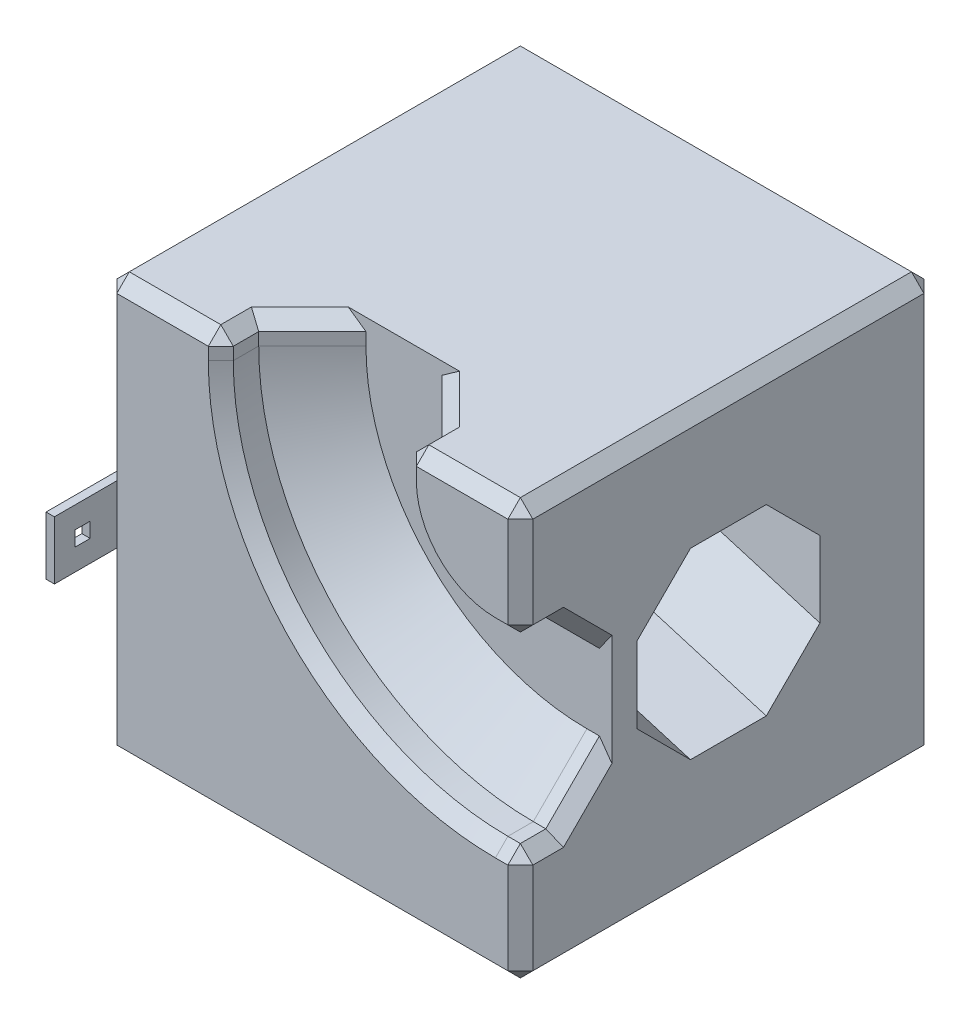
from build123d import *

# Parameters (mm, degrees)
SKETCH1_W                = 50
SKETCH1_H                = 50
BOSS_EXTRUDE1_DEPTH      = 50
CHAMFER1_SIZE            = 1.5
BOSS_EXTRUDE2_DEPTH      = 7
BOSS_EXTRUDE2_DEPTH_BACK = 7
SKETCH6_W                = 1
SKETCH6_H                = 7
SKETCH7_W                = 1.8
SKETCH7_H                = 1.8
CUT_EXTRUDE1_DEPTH       = 7


with BuildPart() as part:
    # Sketch1 → Boss-Extrude1 (new body)
    with BuildSketch(Plane.XY):
        with Locations((25, 25)):
            Rectangle(SKETCH1_W, SKETCH1_H)
    extrude(amount=BOSS_EXTRUDE1_DEPTH)

    # Cut-Sweep2: sweep along a path in Sketch4
    with BuildLine(Plane.XY.offset(50)) as cut_sweep2_path:
        Line((25, 50), (25, 47))
        ThreePointArc((25, 47), (31.443650814, 31.443650814), (47, 25))
        Line((47, 25), (50, 25))
    # Sketch3 → Cut-Sweep2 (sweep, cut)
    with BuildSketch(Plane.XZ.offset(-50)):
        Polygon((29.556349186, 39), (36, 45.443650814), (36, 54.556349186), (29.556349186, 61), (20.443650814, 61), (14, 54.556349186), (14, 45.443650814), (20.443650814, 39), align=None)
    sweep(path=cut_sweep2_path.line, mode=Mode.SUBTRACT)

    # Sketch5 → Cut-Loft1 section 0
    with BuildSketch(Plane.ZY):
        with BuildLine():
            Line((24.5, 20.443650814), (24.5, 29.556349186))
            Line((24.5, 29.556349186), (18.056349186, 36))
            Line((18.056349186, 36), (8.943650814, 36))
            Line((8.943650814, 36), (2.5, 29.556349186))
            Line((2.5, 29.556349186), (2.5, 20.443650814))
            Line((2.5, 20.443650814), (8.943650814, 14))
            Line((8.943650814, 14), (18.056349186, 14))
            Line((18.056349186, 14), (24.5, 20.443650814))
        make_face()
    # Sketch2 → Cut-Loft1 section 1
    with BuildSketch(Plane.ZY.offset(-50)):
        with BuildLine():
            Line((36, 29.556349186), (29.556349186, 36))
            Line((29.556349186, 36), (20.443650814, 36))
            Line((20.443650814, 36), (14, 29.556349186))
            Line((14, 29.556349186), (14, 20.443650814))
            Line((14, 20.443650814), (20.443650814, 14))
            Line((20.443650814, 14), (29.556349186, 14))
            Line((29.556349186, 14), (36, 20.443650814))
            Line((36, 20.443650814), (36, 29.556349186))
        make_face()
    loft(mode=Mode.SUBTRACT)

    # Chamfer1
    chamfer1_edges = [part.edges().sort_by_distance(p)[0] for p in [
        (50, 7, 50),
        (43, 50, 50),
        (50, 43, 50),
        (7, 50, 50),
        (14, 48.5, 50),
        (23.665476221, 23.665476221, 50),
        (48.5, 14, 50),
        (36, 48.5, 50),
        (39.221825407, 39.221825407, 50),
        (48.5, 36, 50),
        (36, 50, 47.721825407),
        (14, 50, 47.721825407),
        (50, 36, 47.721825407),
        (50, 14, 47.721825407),
        (50, 17.221825407, 42.221825407),
        (50, 32.778174593, 42.221825407),
        (32.778174593, 50, 42.221825407),
        (17.221825407, 50, 42.221825407),
        (0, 25, 50),
        (25, 50, 0),
        (50, 25, 0),
        (25, 0, 0),
        (0, 25, 0),
        (25, 0, 50),
        (0, 50, 25),
        (50, 50, 25),
        (50, 0, 25),
        (0, 0, 25),
    ]]
    chamfer(chamfer1_edges, length=CHAMFER1_SIZE)

    # Sketch6 → Boss-Extrude2 (add, two sides: drawn at the far end of the back side and taken through both)
    with BuildSketch(Plane.XY.offset(50).offset(-BOSS_EXTRUDE2_DEPTH_BACK)):
        with Locations((0.5, 25)):
            Rectangle(SKETCH6_W, SKETCH6_H)
    extrude(amount=BOSS_EXTRUDE2_DEPTH + BOSS_EXTRUDE2_DEPTH_BACK)

    # Sketch7 → Cut-Extrude1 (cut)
    with BuildSketch(Plane(origin=(1, 0, 0), x_dir=(0, 0, -1), z_dir=(1, 0, 0))):
        with Locations((-53.6, 25)):
            Rectangle(SKETCH7_W, SKETCH7_H)
    extrude(amount=-CUT_EXTRUDE1_DEPTH, mode=Mode.SUBTRACT)


solid = part.part
